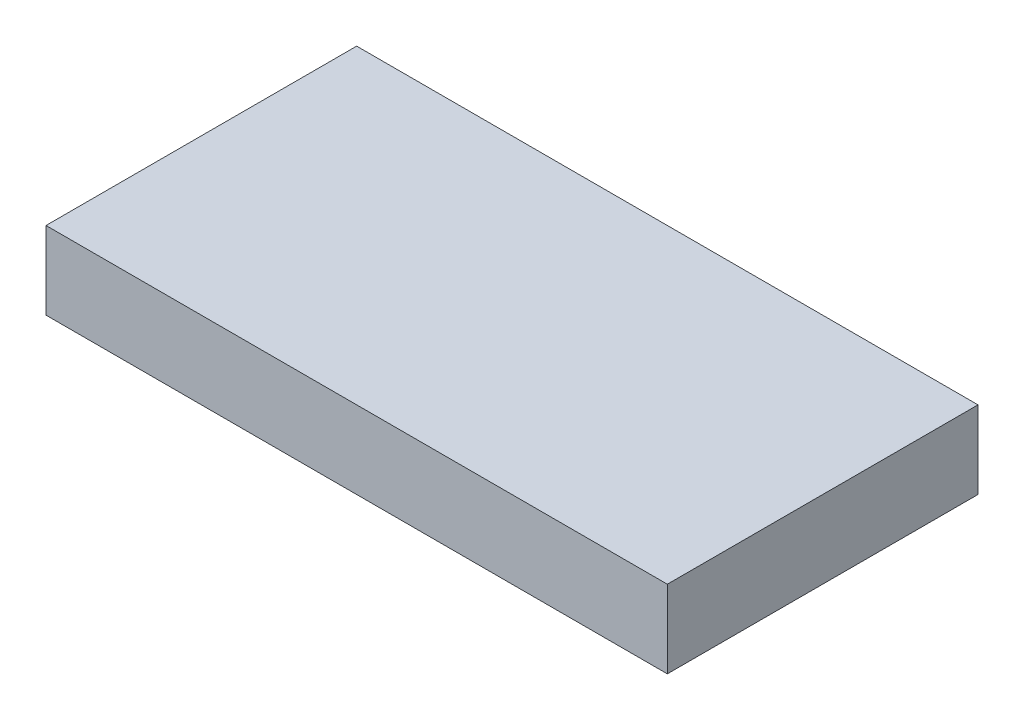
from build123d import *

# Parameters (mm, degrees)
SKETCH1_W           = 50.8
SKETCH1_H           = 25.4
BOSS_EXTRUDE1_DEPTH = 6.35


with BuildPart() as part:
    # Sketch1 → Boss-Extrude1 (new body)
    with BuildSketch(Plane(origin=(0, 0, 0), x_dir=(1, 0, 0), z_dir=(0, 1, 0))):
        Rectangle(SKETCH1_W, SKETCH1_H)
    extrude(amount=BOSS_EXTRUDE1_DEPTH)


solid = part.part
